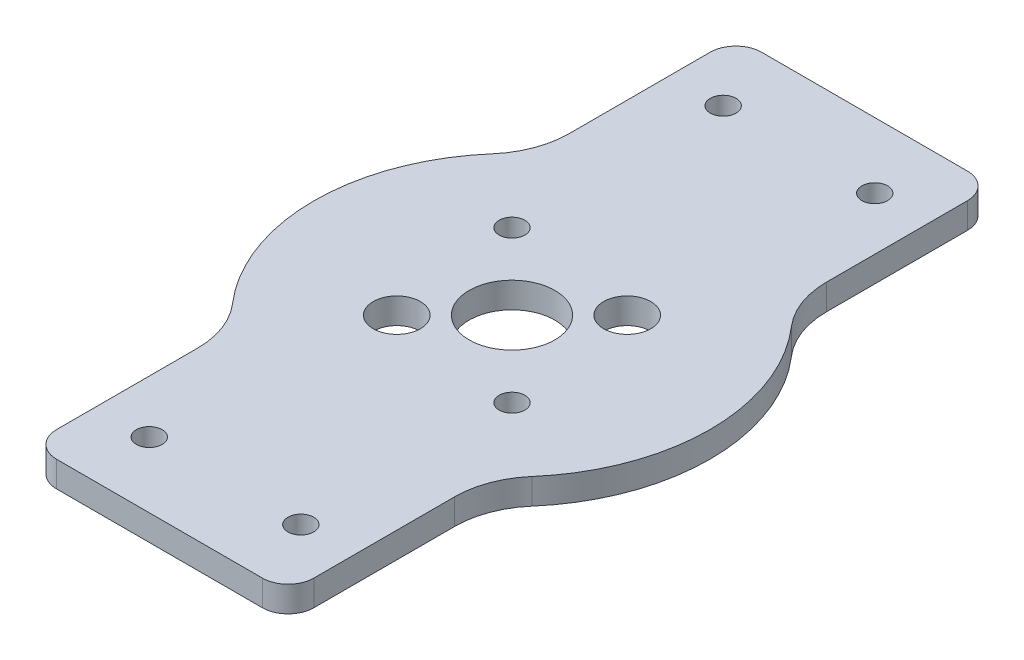
from build123d import *

# Parameters (mm, degrees)
SKETCH1_R           = 1.5
SKETCH1_R_2         = 2.75
SKETCH1_R_3         = 5
BOSS_EXTRUDE1_DEPTH = 3


with BuildPart() as part:
    # Sketch1 → Boss-Extrude1 (new body)
    with BuildSketch(Plane(origin=(0, 0, 0), x_dir=(1, 0, 0), z_dir=(0, 1, 0))):
        with BuildLine():
            Line((-15, 21.693547428), (-15, 38.108016468))
            ThreePointArc((-15, 38.108016468), (-14.121320344, 40.229336812), (-12, 41.108016468))
            Line((-12, 41.108016468), (12, 41.108016468))
            ThreePointArc((12, 41.108016468), (14.121320344, 40.229336812), (15, 38.108016468))
            Line((15, 38.108016468), (15, 21.693547428))
            ThreePointArc((15, 21.693547428), (15.631737063, 18.195598093), (17.447129909, 15.139605607))
            ThreePointArc((17.447129909, 15.139605607), (23.1, 0), (17.447129909, -15.139605607))
            ThreePointArc((17.447129909, -15.139605607), (15.631737063, -18.195598093), (15, -21.693547428))
            Line((15, -21.693547428), (15, -38.108016468))
            ThreePointArc((15, -38.108016468), (14.121320344, -40.229336812), (12, -41.108016468))
            Line((12, -41.108016468), (-12, -41.108016468))
            ThreePointArc((-12, -41.108016468), (-14.121320344, -40.229336812), (-15, -38.108016468))
            Line((-15, -38.108016468), (-15, -21.693547428))
            ThreePointArc((-15, -21.693547428), (-15.631737063, -18.195598093), (-17.447129909, -15.139605607))
            ThreePointArc((-17.447129909, -15.139605607), (-23.1, 0), (-17.447129909, 15.139605607))
            ThreePointArc((-17.447129909, 15.139605607), (-15.631737063, 18.195598093), (-15, 21.693547428))
        make_face()
        with Locations(Location((-8.838834765, 8.838834765, 0), (0, 0, 270))):
            Circle(SKETCH1_R, mode=Mode.SUBTRACT)
        with Locations(Location((8.838834765, -8.838834765, 0), (0, 0, 90))):
            Circle(SKETCH1_R, mode=Mode.SUBTRACT)
        with Locations(Location((6.717514421, 6.717514421, 0), (0, 0, 270))):
            Circle(SKETCH1_R_2, mode=Mode.SUBTRACT)
        with Locations(Location((-6.717514421, -6.717514421, 0), (0, 0, 90))):
            Circle(SKETCH1_R_2, mode=Mode.SUBTRACT)
        with Locations(Location((0, 0, 0), (0, 0, 270))):
            Circle(SKETCH1_R_3, mode=Mode.SUBTRACT)
        with Locations(Location((-8.838834765, 33.462792438, 0), (0, 0, 270))):
            Circle(SKETCH1_R, mode=Mode.SUBTRACT)
        with Locations(Location((8.838834765, 33.462792438, 0), (0, 0, 90))):
            Circle(SKETCH1_R, mode=Mode.SUBTRACT)
        with Locations(Location((8.838834765, -33.462792438, 0), (0, 0, 270))):
            Circle(SKETCH1_R, mode=Mode.SUBTRACT)
        with Locations(Location((-8.838834765, -33.462792438, 0), (0, 0, 90))):
            Circle(SKETCH1_R, mode=Mode.SUBTRACT)
    extrude(amount=BOSS_EXTRUDE1_DEPTH)


solid = part.part
